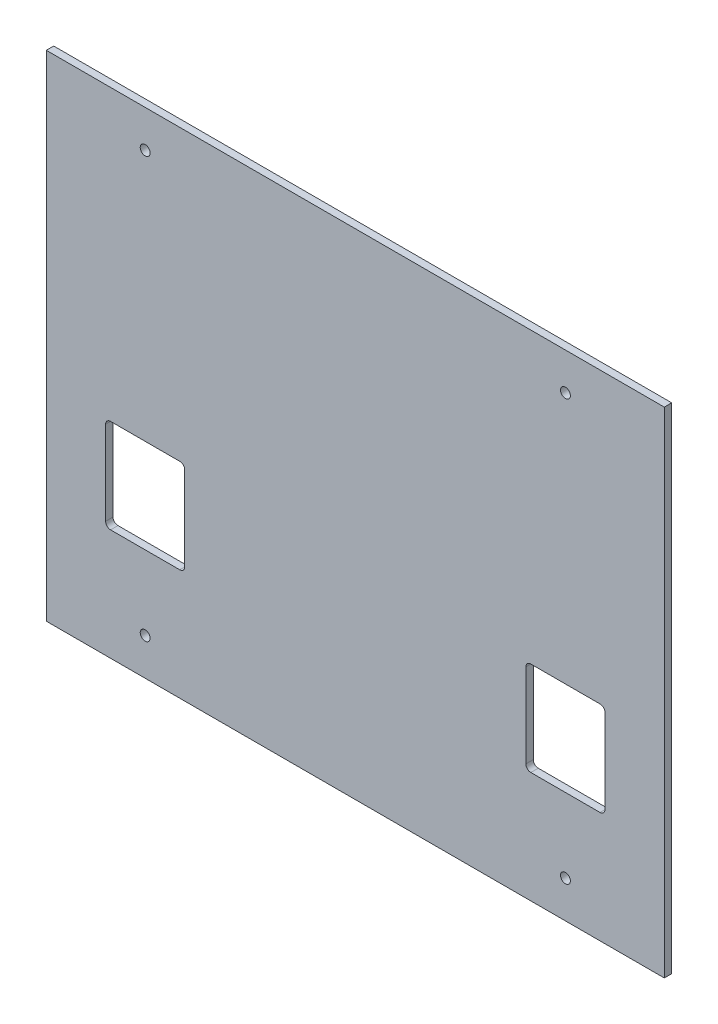
from build123d import *

# Parameters (mm, degrees)
SKETCH1_W           = 250
SKETCH1_H           = 200
BOSS_EXTRUDE1_DEPTH = 3
SKETCH3_R           = 2
CUT_EXTRUDE2_DEPTH  = 3
CUT_EXTRUDE3_DEPTH  = 10


with BuildPart() as part:
    # Sketch1 → Boss-Extrude1 (new body)
    with BuildSketch(Plane.XY):
        Rectangle(SKETCH1_W, SKETCH1_H)
    extrude(amount=BOSS_EXTRUDE1_DEPTH)

    # Sketch3 → Cut-Extrude2 (cut)
    with BuildSketch(Plane.XY.offset(3)):
        with Locations((-85, 85)):
            Circle(SKETCH3_R)
        with Locations((-85, -85)):
            Circle(SKETCH3_R)
        with Locations((-85, -425)):
            Circle(SKETCH3_R)
        with Locations((85, -425)):
            Circle(SKETCH3_R)
        with Locations(Location((85, -85, 0), (0, 0, 180))):
            Circle(SKETCH3_R)
        with Locations(Location((85, 85, 0), (0, 0, 180))):
            Circle(SKETCH3_R)
    extrude(amount=-CUT_EXTRUDE2_DEPTH, mode=Mode.SUBTRACT)

    # Sketch4 → Cut-Extrude3 (cut)
    with BuildSketch(Plane(origin=(0, 0, 0), x_dir=(-1, 0, 0), z_dir=(0, 0, -1))):
        with BuildLine():
            Line((-99, -17), (-71, -17))
            ThreePointArc((-71, -17), (-69.585786438, -17.585786438), (-69, -19))
            Line((-69, -19), (-69, -53))
            ThreePointArc((-69, -53), (-69.585786438, -54.414213562), (-71, -55))
            Line((-71, -55), (-99, -55))
            ThreePointArc((-99, -55), (-100.414213562, -54.414213562), (-101, -53))
            Line((-101, -53), (-101, -19))
            ThreePointArc((-101, -19), (-100.414213562, -17.585786438), (-99, -17))
        make_face()
        with BuildLine():
            Line((69, -19), (69, -53))
            ThreePointArc((69, -53), (69.585786438, -54.414213562), (71, -55))
            Line((71, -55), (99, -55))
            ThreePointArc((99, -55), (100.414213562, -54.414213562), (101, -53))
            Line((101, -53), (101, -19))
            ThreePointArc((101, -19), (100.414213562, -17.585786438), (99, -17))
            Line((99, -17), (71, -17))
            ThreePointArc((71, -17), (69.585786438, -17.585786438), (69, -19))
        make_face()
    extrude(amount=-CUT_EXTRUDE3_DEPTH, mode=Mode.SUBTRACT)


solid = part.part
